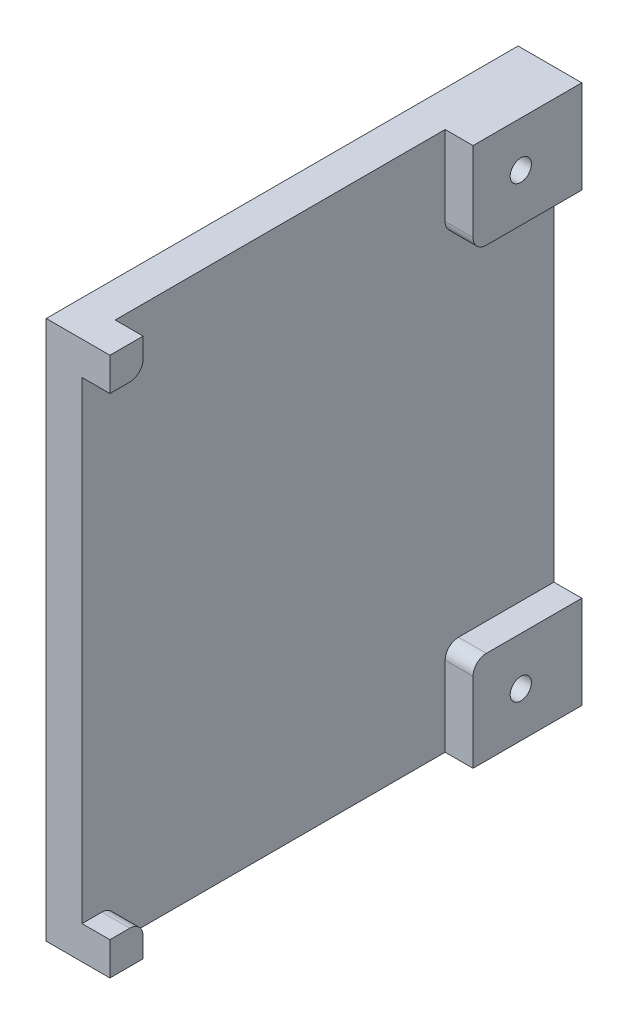
from build123d import *

# Parameters (mm, degrees)
SKETCH1_W           = 40.64
SKETCH1_H           = 35.56
BOSS_EXTRUDE1_DEPTH = 3
SKETCH3_W           = 7.0036
SKETCH3_H           = 8.1974
SKETCH3_W_2         = 2.5
SKETCH3_H_2         = 2.5
BOSS_EXTRUDE2_DEPTH = 2.1
SKETCH4_R           = 0.8
CUT_EXTRUDE2_DEPTH  = 28.47800575
FILLET1_R           = 1
CHAMFER1_SIZE       = 0.3


with BuildPart() as part:
    # Sketch1 → Boss-Extrude1 (new body)
    with BuildSketch(Plane.YZ):
        Rectangle(SKETCH1_W, SKETCH1_H)
    extrude(amount=BOSS_EXTRUDE1_DEPTH)

    # Sketch3 → Boss-Extrude2 (add)
    with BuildSketch(Plane.YZ.offset(3)):
        with Locations((-16.8182, -13.6813)):
            Rectangle(SKETCH3_W, SKETCH3_H)
        with Locations((16.8182, -13.6813)):
            Rectangle(SKETCH3_W, SKETCH3_H)
        with Locations((19.07, 16.53)):
            Rectangle(SKETCH3_W_2, SKETCH3_H_2)
        with Locations((-19.07, 16.53)):
            Rectangle(SKETCH3_W_2, SKETCH3_H_2)
    extrude(amount=BOSS_EXTRUDE2_DEPTH)

    # Sketch4 → Cut-Extrude2 (cut, through all)
    with BuildSketch(Plane.YZ.offset(5.1)):
        with Locations(Location((-16.9164, -13.1826, 0), (0, 0, 270))):
            Circle(SKETCH4_R)
        with Locations(Location((16.9164, -13.1826, 0), (0, 0, 270))):
            Circle(SKETCH4_R)
    extrude(amount=-CUT_EXTRUDE2_DEPTH, mode=Mode.SUBTRACT)

    # Fillet1
    fillet1_edges = [part.edges().sort_by_distance(p)[0] for p in [
        (4.05, -17.82, 15.28),
        (4.05, 17.82, 15.28),
        (4.05, 13.3164, -9.5826),
        (4.05, -13.3164, -9.5826),
    ]]
    fillet(fillet1_edges, radius=FILLET1_R)

    # Chamfer1
    chamfer1_edges = [part.edges().sort_by_distance(p)[0] for p in [
        (0, 0, -17.78),
        (0, -20.32, 0),
        (0, 0, 17.78),
        (0, -16.9164, -12.3826),
        (0, 20.32, 0),
        (0, 16.9164, -12.3826),
    ]]
    chamfer(chamfer1_edges, length=CHAMFER1_SIZE)


solid = part.part
